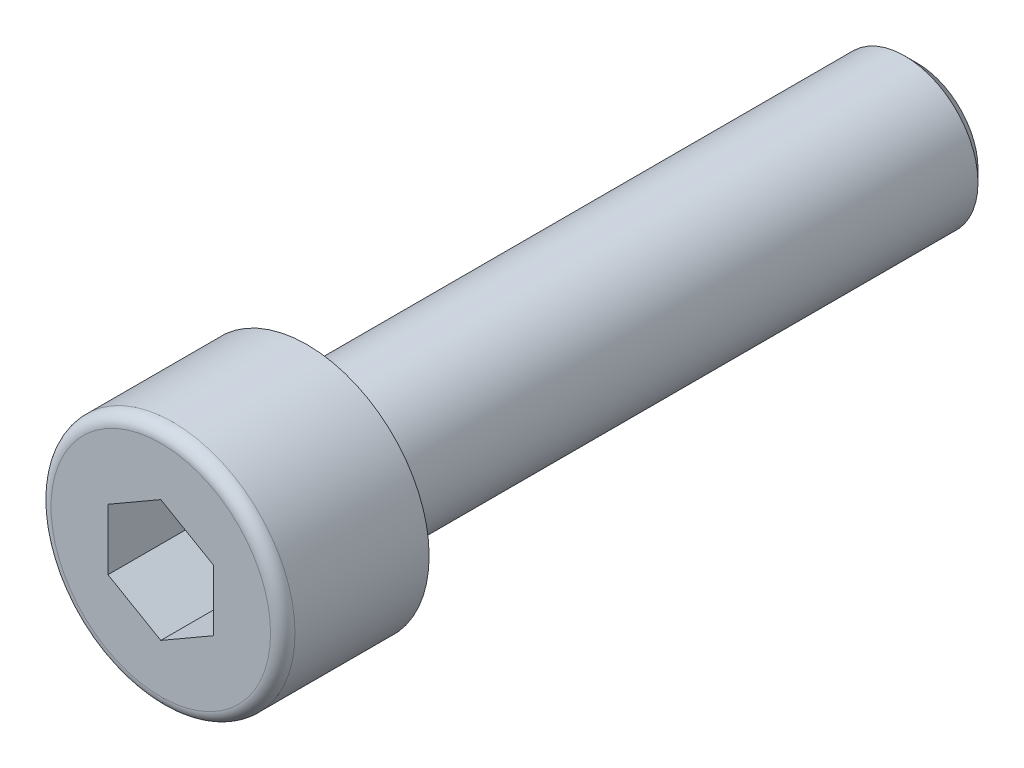
from build123d import *

# Parameters (mm, degrees)
ESQUISSE1_R             = 3
BASE_EXTRUSION_DEPTH    = 31
CHANFREIN1_SIZE         = 0.5
ESQUISSE2_R             = 5
BOSS_EXTRU_1_DEPTH      = 6
ENL_V_MAT_EXTRU_1_DEPTH = 3.5
CONG_2_R                = 0.5


with BuildPart() as part:
    # Esquisse1 → Base-Extrusion (new body)
    with BuildSketch(Plane.XY):
        Circle(ESQUISSE1_R)
    extrude(amount=BASE_EXTRUSION_DEPTH)

    # Chanfrein1
    chanfrein1_edges = [part.edges().sort_by_distance(p)[0] for p in [
        (-3, 0, 0),
    ]]
    chamfer(chanfrein1_edges, length=CHANFREIN1_SIZE)

    # Esquisse2 → Boss.-Extru.1 (add)
    with BuildSketch(Plane.XY.offset(25)):
        Circle(ESQUISSE2_R)
    extrude(amount=BOSS_EXTRU_1_DEPTH)

    # Esquisse3 → Enlèv. mat.-Extru.1 (cut)
    with BuildSketch(Plane.XY.offset(31)):
        Polygon((0, 2.5), (-2.165063509, 1.25), (-2.165063509, -1.25), (0, -2.5), (2.165063509, -1.25), (2.165063509, 1.25), align=None)
    extrude(amount=-ENL_V_MAT_EXTRU_1_DEPTH, mode=Mode.SUBTRACT)

    # Congé2
    cong_2_edges = [part.edges().sort_by_distance(p)[0] for p in [
        (-5, 0, 31),
    ]]
    fillet(cong_2_edges, radius=CONG_2_R)


solid = part.part
